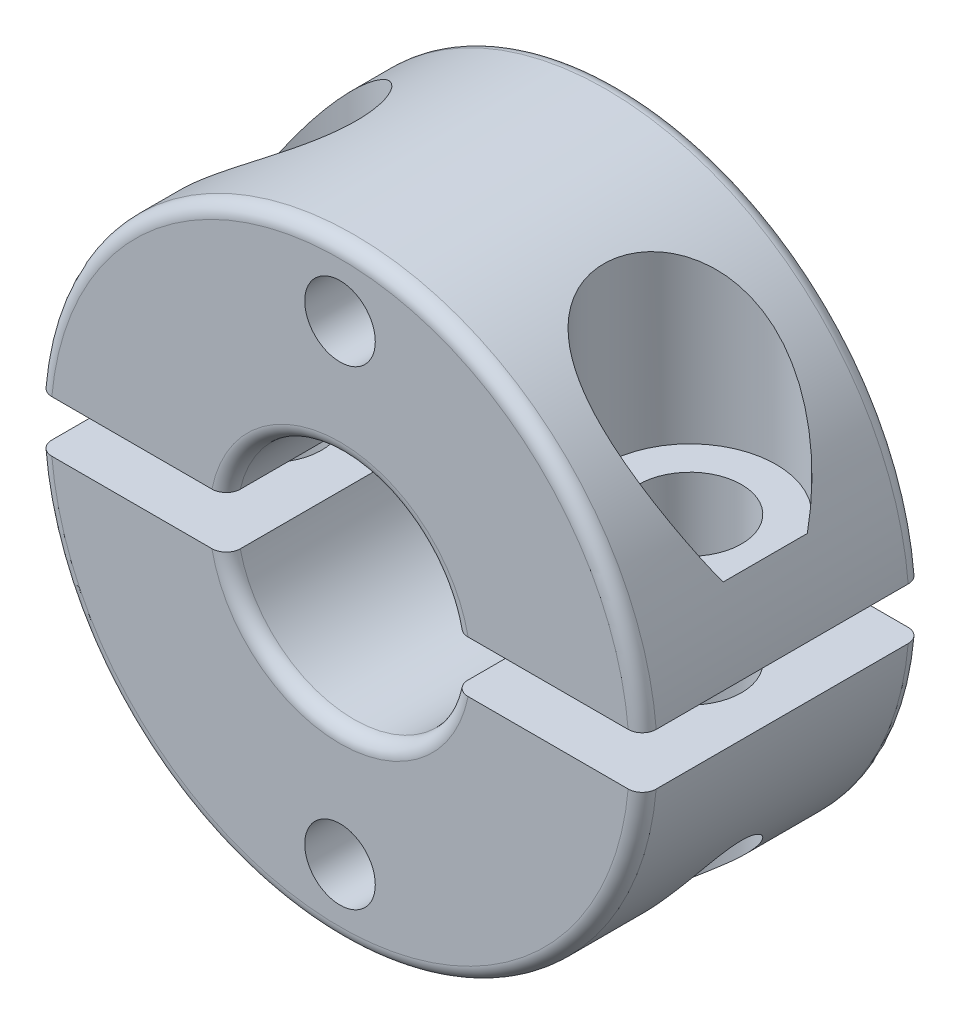
from build123d import *

# Parameters (mm, degrees)
EXTRUDE1_DEPTH                = 4.7625
EXTRUDE1_2_DEPTH              = 4.7625
FILLET1_R                     = 0.47625
FILLET2_R                     = 0.47625
SKETCH8_R                     = 1.7526
CUT_EXTRUDE3_DEPTH            = 18.874905871
SKETCH10_W                    = 1.2
SKETCH10_H                    = 9.553399824
M2_CLEARANCE_HOLE1_AT_2_COUNT = 2
M2_CLEARANCE_HOLE1_AT_2_PITCH = 16


with BuildPart() as part:
    # Sketch1 → Extrude1 (new, symmetric)
    with BuildSketch(Plane.XY):
        with BuildLine():
            Line((-10.281405941, 0.87709375), (-3.870617924, 0.87709375))
            ThreePointArc((-3.870617924, 0.87709375), (0, 3.96875), (3.870617924, 0.87709375))
            Line((3.870617924, 0.87709375), (10.281405941, 0.87709375))
            ThreePointArc((10.281405941, 0.87709375), (0, 10.31875), (-10.281405941, 0.87709375))
        make_face()
    extrude(amount=EXTRUDE1_DEPTH, both=True)

    # Fillet1
    fillet1_edges = [part.edges().sort_by_distance(p)[0] for p in [
        (0, 3.96875, 4.7625),
        (0, 10.31875, 4.7625),
        (0, 3.96875, -4.7625),
        (0, 10.31875, -4.7625),
    ]]
    fillet(fillet1_edges, radius=FILLET1_R)


with BuildPart() as body_2:
    # Sketch1 → Extrude1 2 (new, symmetric)
    with BuildSketch(Plane.XY):
        with BuildLine():
            Line((-10.281405941, -0.87709375), (-3.870617924, -0.87709375))
            ThreePointArc((-3.870617924, -0.87709375), (0, -3.96875), (3.870617924, -0.87709375))
            Line((3.870617924, -0.87709375), (10.281405941, -0.87709375))
            ThreePointArc((10.281405941, -0.87709375), (0, -10.31875), (-10.281405941, -0.87709375))
        make_face()
    extrude(amount=EXTRUDE1_2_DEPTH, both=True)

    # Fillet2
    fillet2_edges = [body_2.edges().sort_by_distance(p)[0] for p in [
        (0, -3.96875, 4.7625),
        (0, -10.31875, 4.7625),
        (0, -3.96875, -4.7625),
        (0, -10.31875, -4.7625),
    ]]
    fillet(fillet2_edges, radius=FILLET2_R)


with BuildPart() as cut_revolve1_tool:
    # Sketch2 → Cut-Revolve1 (revolve)
    with BuildSketch(Plane(origin=(0, 0, 0), x_dir=(1, 0, 0), z_dir=(0, 1, 0))):
        with BuildLine():
            Line((-7.33425, 4.7625), (-6.95325, 4.7625))
            ThreePointArc((-6.95325, 4.7625), (-7.14375, 4.572), (-7.33425, 4.7625))
        make_face()
    revolve(axis=Axis((0, 0, -4.7625), (0, 0, 1)))


with BuildPart() as part_1:
    add(part.part)

    # Cut-Revolve1: cut by cut_revolve1_tool
    add(cut_revolve1_tool.part, mode=Mode.SUBTRACT)


with BuildPart() as body_2_1:
    add(body_2.part)

    # Cut-Revolve1: cut by cut_revolve1_tool
    add(cut_revolve1_tool.part, mode=Mode.SUBTRACT)


with BuildPart() as cut_revolve2_tool:
    # Sketch3 → Cut-Revolve2 (revolve)
    with BuildSketch(Plane.XY):
        Polygon((-7.14375, 10.31875), (-4.21005, 10.31875), (-4.21005, 3.50599375), (-5.39115, 3.50599375), (-5.39115, -10.31875), (-7.14375, -10.31875), align=None)
    cut_revolve2 = revolve(axis=Axis((-7.14375, -10.31875, 0), (0, 1, 0)))


with BuildPart() as part_2:
    add(part_1.part)

    # Cut-Revolve2: cut by cut_revolve2_tool
    add(cut_revolve2_tool.part, mode=Mode.SUBTRACT)

    # Mirror1: Cut-Revolve2 across plane
    add(cut_revolve2.mirror(Plane(origin=(0, 0, 0), x_dir=(0, 0, 1), z_dir=(1, 0, 0))), mode=Mode.SUBTRACT)

    # Sketch10 → M2 Clearance Hole1 (revolve, cut)
    with BuildSketch(Plane(origin=(0, 8, -4.7625), x_dir=(0, 1, 0), z_dir=(1, 0, 0))):
        with Locations((0.6, 4.776699912)):
            Rectangle(SKETCH10_W, SKETCH10_H)
    m2_clearance_hole1 = revolve(axis=Axis((0, 8, -11.1125), (0, 0, 1)), mode=Mode.SUBTRACT)


with BuildPart() as body_2_2:
    add(body_2_1.part)

    # Cut-Revolve2: cut by cut_revolve2_tool
    add(cut_revolve2_tool.part, mode=Mode.SUBTRACT)

    # Sketch8 → Cut-Extrude3 (cut, through all)
    with BuildSketch(Plane(origin=(0, 3.50599375, 0), x_dir=(1, 0, 0), z_dir=(0, 1, 0))):
        with Locations(Location((7.14375, 0, 0), (0, 0, 90))):
            Circle(SKETCH8_R)
    extrude(amount=-CUT_EXTRUDE3_DEPTH, mode=Mode.SUBTRACT)

    # M2 Clearance Hole1 at 2: M2 Clearance Hole1 ×2
    with Locations(*[(0, -i * M2_CLEARANCE_HOLE1_AT_2_PITCH, 0) for i in range(1, M2_CLEARANCE_HOLE1_AT_2_COUNT)]):
        add(m2_clearance_hole1, mode=Mode.SUBTRACT)


solid = Compound([part_2.part, body_2_2.part])
